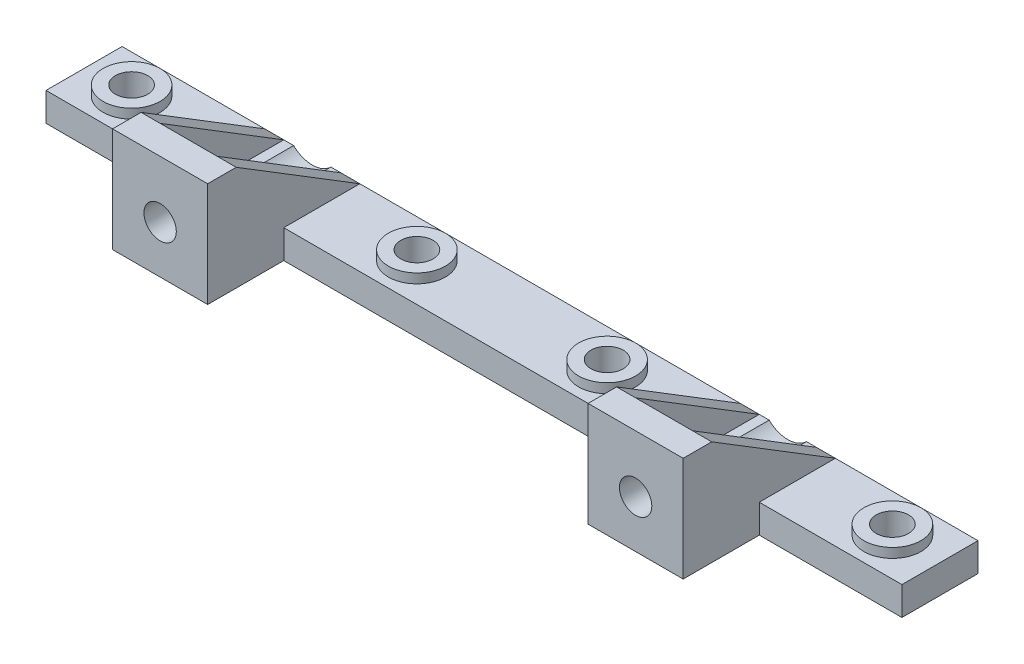
from build123d import *

# Parameters (mm, degrees)
SKETCH_1_W          = 90
SKETCH_1_H          = 8
SKETCH_1_R          = 1.7
EXTRUDE_1_DEPTH     = 3
SKETCH_2_W          = 10
SKETCH_2_H          = 3
EXTRUDE_2_DEPTH     = 8
SKETCH_3_W          = 10
SKETCH_3_H          = 3
EXTRUDE_3_DEPTH     = 8
SKETCH_4_R          = 1.7
CUT_EXTRUDE_1_DEPTH = 49.114446895
EXTRUDE_4_DEPTH     = 2
EXTRUDE_5_DEPTH     = 2
SKETCH_7_R          = 2.8
CUT_EXTRUDE_2_DEPTH = 49.114446895
SKETCH_8_R          = 3
SKETCH_8_R_2        = 1.7
EXTRUDE_6_DEPTH     = 1


with BuildPart() as part:
    # 草图1 → 凸台-拉伸1 (new body)
    with BuildSketch(Plane(origin=(0, 0, 0), x_dir=(1, 0, 0), z_dir=(0, 1, 0))):
        Rectangle(SKETCH_1_W, SKETCH_1_H)
        with Locations(Location((-10, 0, 0), (0, 0, 270))):
            Circle(SKETCH_1_R, mode=Mode.SUBTRACT)
        with Locations(Location((10, 0, 0), (0, 0, 270))):
            Circle(SKETCH_1_R, mode=Mode.SUBTRACT)
        with Locations(Location((40, 0, 0), (0, 0, 270))):
            Circle(SKETCH_1_R, mode=Mode.SUBTRACT)
        with Locations(Location((-40, 0, 0), (0, 0, 270))):
            Circle(SKETCH_1_R, mode=Mode.SUBTRACT)
    extrude(amount=EXTRUDE_1_DEPTH)

    # 草图2 → 凸台-拉伸2 (add)
    with BuildSketch(Plane(origin=(0, 0, 4), x_dir=(-1, 0, 0), z_dir=(0, 0, -1))):
        with Locations((25, 1.5)):
            Rectangle(SKETCH_2_W, SKETCH_2_H)
    extrude_2 = extrude(amount=-EXTRUDE_2_DEPTH)

    # 草图3 → 凸台-拉伸3 (add)
    with BuildSketch(Plane(origin=(0, 3, 0), x_dir=(1, 0, 0), z_dir=(0, 1, 0))):
        with Locations((-25, -10.5)):
            Rectangle(SKETCH_3_W, SKETCH_3_H)
    extrude_3 = extrude(amount=EXTRUDE_3_DEPTH)

    # 草图4 → 切除-拉伸1 (cut, through all)
    with BuildSketch(Plane(origin=(0, 0, 9), x_dir=(-1, 0, 0), z_dir=(0, 0, -1))):
        with Locations((25, 5)):
            Circle(SKETCH_4_R)
    cut_extrude_1 = extrude(amount=-CUT_EXTRUDE_1_DEPTH, mode=Mode.SUBTRACT)

    # 草图5 → 凸台-拉伸4 (add)
    with BuildSketch(Plane(origin=(-20, 0, 0), x_dir=(0, 0, -1), z_dir=(1, 0, 0))):
        Polygon((-9, 11), (4, 3), (-9, 3), align=None)
    extrude_4 = extrude(amount=-EXTRUDE_4_DEPTH)

    # 草图6 → 凸台-拉伸5 (add)
    with BuildSketch(Plane.ZY.offset(30)):
        Polygon((9, 11), (-4, 3), (9, 3), align=None)
    extrude_5 = extrude(amount=-EXTRUDE_5_DEPTH)

    # 草图7 → 切除-拉伸2 (cut, through all)
    with BuildSketch(Plane(origin=(0, 0, 9), x_dir=(-1, 0, 0), z_dir=(0, 0, -1))):
        with Locations((25, 5)):
            Circle(SKETCH_7_R)
    cut_extrude_2 = extrude(amount=CUT_EXTRUDE_2_DEPTH, mode=Mode.SUBTRACT)

    # 镜向1: 凸台-拉伸2, 凸台-拉伸3, 切除-拉伸1, 凸台-拉伸4, 凸台-拉伸5, 切除-拉伸2 across plane
    add(extrude_2.mirror(Plane(origin=(0, 0, 0), x_dir=(0, 0, 1), z_dir=(1, 0, 0))))
    add(extrude_3.mirror(Plane(origin=(0, 0, 0), x_dir=(0, 0, 1), z_dir=(1, 0, 0))))
    add(cut_extrude_1.mirror(Plane(origin=(0, 0, 0), x_dir=(0, 0, 1), z_dir=(1, 0, 0))), mode=Mode.SUBTRACT)
    add(extrude_4.mirror(Plane(origin=(0, 0, 0), x_dir=(0, 0, 1), z_dir=(1, 0, 0))))
    add(extrude_5.mirror(Plane(origin=(0, 0, 0), x_dir=(0, 0, 1), z_dir=(1, 0, 0))))
    add(cut_extrude_2.mirror(Plane(origin=(0, 0, 0), x_dir=(0, 0, 1), z_dir=(1, 0, 0))), mode=Mode.SUBTRACT)

    # 草图8 → 凸台-拉伸6 (add)
    # profile 1 of 4: a face of its own
    with BuildSketch(Plane(origin=(0, 3, 0), x_dir=(1, 0, 0), z_dir=(0, 1, 0))):
        with Locations(Location((-40, 0, 0), (0, 0, 270))):
            Circle(SKETCH_8_R)
        with Locations(Location((-40, 0, 0), (0, 0, 270))):
            Circle(SKETCH_8_R_2, mode=Mode.SUBTRACT)
    # profile 2 of 4: a face of its own
    with BuildSketch(Plane(origin=(0, 3, 0), x_dir=(1, 0, 0), z_dir=(0, 1, 0))):
        with Locations(Location((-10, 0, 0), (0, 0, 270))):
            Circle(SKETCH_8_R)
        with Locations(Location((-10, 0, 0), (0, 0, 270))):
            Circle(SKETCH_8_R_2, mode=Mode.SUBTRACT)
    # profile 3 of 4: a face of its own
    with BuildSketch(Plane(origin=(0, 3, 0), x_dir=(1, 0, 0), z_dir=(0, 1, 0))):
        with Locations(Location((10, 0, 0), (0, 0, 270))):
            Circle(SKETCH_8_R)
        with Locations(Location((10, 0, 0), (0, 0, 270))):
            Circle(SKETCH_8_R_2, mode=Mode.SUBTRACT)
    # profile 4 of 4: a face of its own
    with BuildSketch(Plane(origin=(0, 3, 0), x_dir=(1, 0, 0), z_dir=(0, 1, 0))):
        with Locations(Location((40, 0, 0), (0, 0, 270))):
            Circle(SKETCH_8_R)
        with Locations(Location((40, 0, 0), (0, 0, 270))):
            Circle(SKETCH_8_R_2, mode=Mode.SUBTRACT)
    extrude(amount=EXTRUDE_6_DEPTH)


solid = part.part
